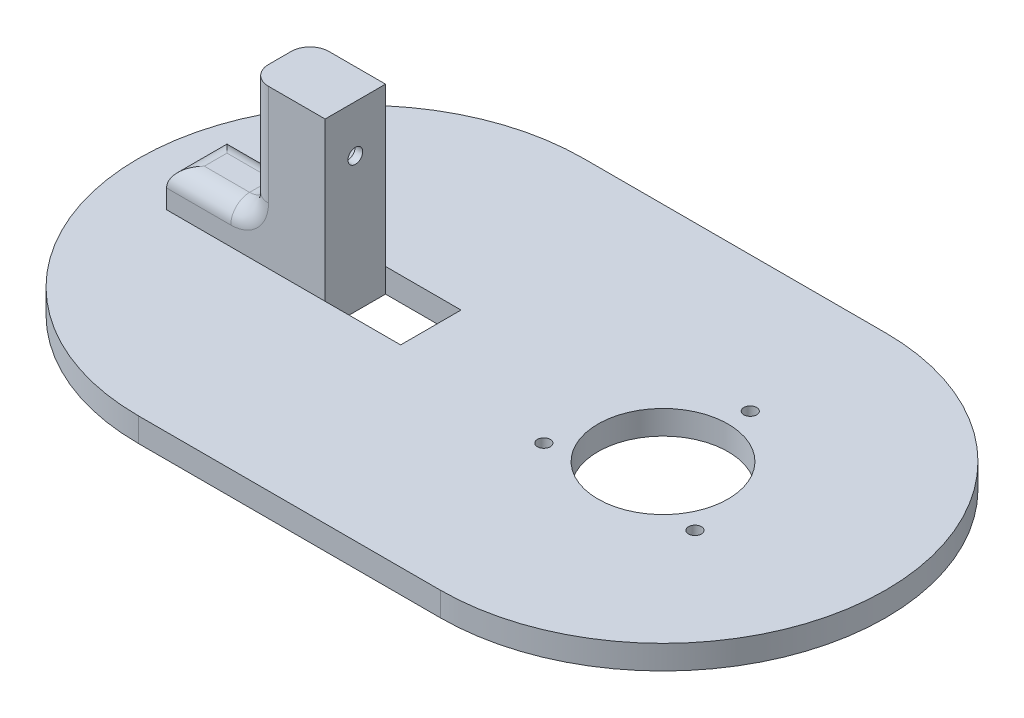
from build123d import *

# Parameters (mm, degrees)
BOSS_EXTRU_1_DEPTH                  = 3.175
ESQUISSE3_W                         = 42
ESQUISSE3_H                         = 16
BOSS_EXTRU_2_DEPTH                  = 45
ESQUISSE4_W                         = 20
ESQUISSE4_H                         = 16
ENL_V_MAT_EXTRU_1_DEPTH             = 123.60232716
ESQUISSE5_W                         = 22
ESQUISSE5_H                         = 31.825
ENL_V_MAT_EXTRU_2_DEPTH             = 128.730184373
CONG_1_R                            = 5
D_GAGEMENT_M3_51_D                  = 3.9
D_GAGEMENT_M31_D                    = 3.4
ESQUISSE11_R                        = 17.225
ENL_V_MAT_EXTRU_3_DEPTH             = 123.60232716
DIAM_TRE_DU_PER_AGE_4_5_4_5_2_D     = 4.5
DIAM_TRE_DU_PER_AGE_4_5_4_5_2_DEPTH = 5.8
ENL_V_MAT_EXTRU_4_DEPTH             = 18


with BuildPart() as part:
    # Esquisse1 → Boss.-Extru.1 (new, symmetric)
    with BuildSketch(Plane(origin=(0, 0, 0), x_dir=(1, 0, 0), z_dir=(0, 1, 0))):
        with BuildLine():
            Line((-40, 59), (40, 59))
            ThreePointArc((40, 59), (99, 0), (40, -59))
            Line((40, -59), (-40, -59))
            ThreePointArc((-40, -59), (-99, 0), (-40, 59))
        make_face()
    extrude(amount=BOSS_EXTRU_1_DEPTH, both=True)

    # Esquisse3 → Boss.-Extru.2 (add)
    with BuildSketch(Plane(origin=(0, 0, 0), x_dir=(1, 0, 0), z_dir=(0, 1, 0))):
        with Locations((-62.5, 0)):
            Rectangle(ESQUISSE3_W, ESQUISSE3_H)
    extrude(amount=BOSS_EXTRU_2_DEPTH)

    # Esquisse4 → Enlèv. mat.-Extru.1 (cut, through all)
    with BuildSketch(Plane(origin=(0, 3.175, 0), x_dir=(1, 0, 0), z_dir=(0, 1, 0))):
        with Locations((-31.5, 0)):
            Rectangle(ESQUISSE4_W, ESQUISSE4_H)
    extrude(amount=-ENL_V_MAT_EXTRU_1_DEPTH, mode=Mode.SUBTRACT)

    # Esquisse5 → Enlèv. mat.-Extru.2 (cut, through all)
    with BuildSketch(Plane.XY.offset(8)):
        with Locations((-72.5, 29.0875)):
            Rectangle(ESQUISSE5_W, ESQUISSE5_H)
    extrude(amount=-ENL_V_MAT_EXTRU_2_DEPTH, mode=Mode.SUBTRACT)

    # Congé1
    cong_1_edges = [part.edges().sort_by_distance(p)[0] for p in [
        (-72.5, 13.175, -8),
        (-61.5, 13.175, 0),
        (-83.5, 13.175, 0),
        (-61.5, 29.0875, 8),
        (-61.5, 29.0875, -8),
        (-72.5, 13.175, 8),
    ]]
    fillet(cong_1_edges, radius=CONG_1_R)

    # Dégagement M3.51 (through all)
    with Locations(Plane(origin=(-41.5, 0, 0), x_dir=(0, 0, -1), z_dir=(1, 0, 0))):
        with Locations((0, 32.55)):
            Hole(D_GAGEMENT_M3_51_D / 2)

    # Dégagement M31 (through all)
    with Locations(Plane(origin=(0, 3.175, 0), x_dir=(1, 0, 0), z_dir=(0, 1, 0))):
        with Locations((60.016012145, -11.55625), (40, 23.1125), (19.983987855, -11.55625)):
            Hole(D_GAGEMENT_M31_D / 2)

    # Esquisse11 → Enlèv. mat.-Extru.3 (cut, through all)
    with BuildSketch(Plane(origin=(0, 3.175, 0), x_dir=(1, 0, 0), z_dir=(0, 1, 0))):
        with Locations(Location((40, 0, 0), (0, 0, 270))):
            Circle(ESQUISSE11_R)
    extrude(amount=-ENL_V_MAT_EXTRU_3_DEPTH, mode=Mode.SUBTRACT)

    # Diamètre du perçage Ø4.5 (4.5)2
    with Locations(Plane(origin=(0, -3.175, 0), x_dir=(-1, 0, 0), z_dir=(0, -1, 0))):
        with Locations((78.5, 0), (66.5, 0)):
            Hole(DIAM_TRE_DU_PER_AGE_4_5_4_5_2_D / 2, depth=DIAM_TRE_DU_PER_AGE_4_5_4_5_2_DEPTH)

    # Esquisse14 → Enlèv. mat.-Extru.4 (cut)
    with BuildSketch(Plane.ZY.offset(61.5)):
        Polygon((4.67653718, 32.55), (2.33826859, 36.6), (-2.33826859, 36.6), (-4.67653718, 32.55), (-2.33826859, 28.5), (2.33826859, 28.5), align=None)
    extrude(amount=-ENL_V_MAT_EXTRU_4_DEPTH, mode=Mode.SUBTRACT)


solid = part.part
